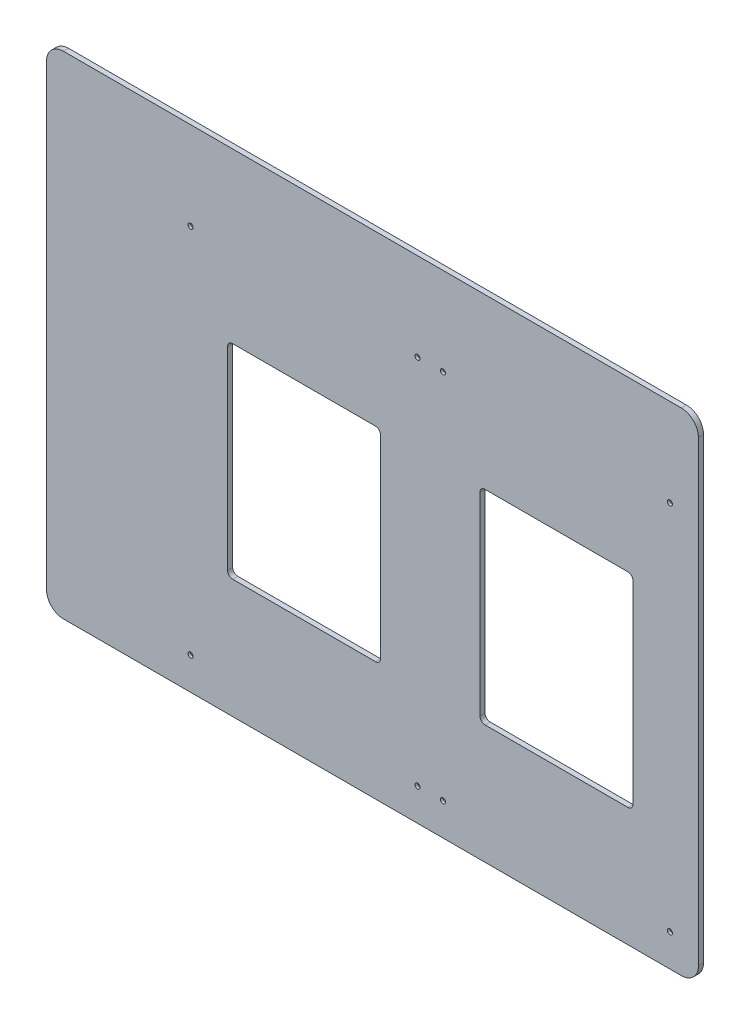
from build123d import *

# Parameters (mm, degrees)
EXTRUDE_1_DEPTH     = 3
SKETCH_1_3_R        = 2.25
CUT_EXTRUDE_1_DEPTH = 1.5
SKETCH_1_4_R        = 1.5
CUT_EXTRUDE_2_DEPTH = 3


with BuildPart() as part:
    # 草图1 → 凸台-拉伸1 (new body)
    with BuildSketch(Plane.XY):
        with BuildLine():
            Line((-68, 39.2), (295.5, 39.2))
            ThreePointArc((295.5, 39.2), (302.571067812, 36.271067812), (305.5, 29.2))
            Line((305.5, 29.2), (305.5, -240))
            ThreePointArc((305.5, -240), (302.571067812, -247.071067812), (295.5, -250))
            Line((295.5, -250), (-68, -250))
            ThreePointArc((-68, -250), (-75.071067812, -247.071067812), (-78, -240))
            Line((-78, -240), (-78, 29.2))
            ThreePointArc((-78, 29.2), (-75.071067812, 36.271067812), (-68, 39.2))
        make_face()
    extrude(amount=EXTRUDE_1_DEPTH)

    # 草图1<3> → 切除-拉伸1 (cut)
    with BuildSketch(Plane.XY):
        with Locations((6.75, -12.5)):
            Circle(SKETCH_1_3_R)
        with Locations((140.25, -12.5)):
            Circle(SKETCH_1_3_R)
        with Locations((140.25, -231)):
            Circle(SKETCH_1_3_R)
        with Locations((6.75, -231)):
            Circle(SKETCH_1_3_R)
        with Locations((155.25, -12.5)):
            Circle(SKETCH_1_3_R)
        with Locations((288.75, -12.5)):
            Circle(SKETCH_1_3_R)
        with Locations((288.75, -231)):
            Circle(SKETCH_1_3_R)
        with Locations((155.25, -231)):
            Circle(SKETCH_1_3_R)
    extrude(amount=CUT_EXTRUDE_1_DEPTH, mode=Mode.SUBTRACT)

    # 草图1<4> → 切除-拉伸2 (cut)
    with BuildSketch(Plane.XY):
        with Locations((6.75, -12.5)):
            Circle(SKETCH_1_4_R)
        with Locations((140.25, -12.5)):
            Circle(SKETCH_1_4_R)
        with Locations((140.25, -231)):
            Circle(SKETCH_1_4_R)
        with Locations((6.75, -231)):
            Circle(SKETCH_1_4_R)
        with Locations((155.25, -12.5)):
            Circle(SKETCH_1_4_R)
        with Locations((288.75, -12.5)):
            Circle(SKETCH_1_4_R)
        with Locations((288.75, -231)):
            Circle(SKETCH_1_4_R)
        with Locations((155.25, -231)):
            Circle(SKETCH_1_4_R)
        with BuildLine():
            Line((31.5, -60), (115.5, -60))
            ThreePointArc((115.5, -60), (117.621320344, -60.878679656), (118.5, -63))
            Line((118.5, -63), (118.5, -177))
            ThreePointArc((118.5, -177), (117.621320344, -179.121320344), (115.5, -180))
            Line((115.5, -180), (31.5, -180))
            ThreePointArc((31.5, -180), (29.378679656, -179.121320344), (28.5, -177))
            Line((28.5, -177), (28.5, -63))
            ThreePointArc((28.5, -63), (29.378679656, -60.878679656), (31.5, -60))
        make_face()
        with BuildLine():
            Line((180, -60), (264, -60))
            ThreePointArc((264, -60), (266.121320344, -60.878679656), (267, -63))
            Line((267, -63), (267, -177))
            ThreePointArc((267, -177), (266.121320344, -179.121320344), (264, -180))
            Line((264, -180), (180, -180))
            ThreePointArc((180, -180), (177.878679656, -179.121320344), (177, -177))
            Line((177, -177), (177, -63))
            ThreePointArc((177, -63), (177.878679656, -60.878679656), (180, -60))
        make_face()
    extrude(amount=CUT_EXTRUDE_2_DEPTH, mode=Mode.SUBTRACT)


solid = part.part
